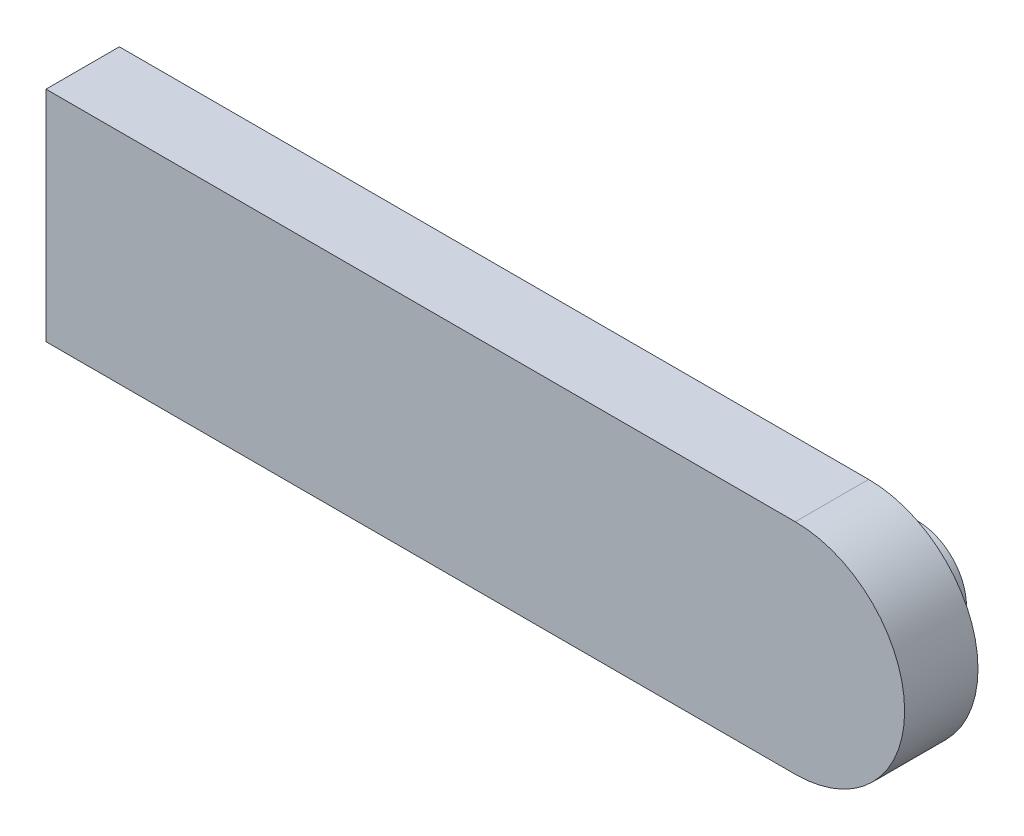
from build123d import *

# Parameters (mm, degrees)
SKETCH_1_W          = 300
SKETCH_1_H          = 44.73
EXTRUDE_1_DEPTH     = 15
CUT_EXTRUDE_4_REACH = 305.687
SKETCH_6_R          = 10
EXTRUDE_2_DEPTH     = 10
SKETCH_7_R          = 1
CUT_EXTRUDE_6_DEPTH = 5


with BuildPart() as part:
    # 草图1 → 凸台-拉伸1 (new body)
    with BuildSketch(Plane.XY):
        with Locations((150, 22.365)):
            Rectangle(SKETCH_1_W, SKETCH_1_H)
    extrude(amount=EXTRUDE_1_DEPTH)

    # 草图4 → 切除-拉伸4 (cut, up to next)
    with BuildSketch(Plane.XY.offset(15), mode=Mode.PRIVATE) as cut_extrude_4_sk1:
        with BuildLine():
            Line((300, 44.73), (153.211623388, 44.73))
            ThreePointArc((153.211623388, 44.73), (175.576623388, 22.365), (153.211623388, 0))
            Line((153.211623388, 0), (300, 0))
            Line((300, 0), (300, 44.73))
        make_face()
    cut_extrude_4_tool1 = extrude(cut_extrude_4_sk1.sketch, amount=-CUT_EXTRUDE_4_REACH, mode=Mode.PRIVATE) & part.part
    add(cut_extrude_4_tool1.solids().sort_by_distance((235.292113, 22.365, 15))[0], mode=Mode.SUBTRACT)

    # 草图6 → 凸台-拉伸2 (add)
    with BuildSketch(Plane(origin=(0, 0, 0), x_dir=(-1, 0, 0), z_dir=(0, 0, -1))):
        with Locations((-153.211623388, 22.365)):
            Circle(SKETCH_6_R)
    extrude(amount=EXTRUDE_2_DEPTH)

    # 草图7 → 切除-拉伸6 (cut)
    with BuildSketch(Plane(origin=(0, 0, -10), x_dir=(-1, 0, 0), z_dir=(0, 0, -1))):
        with Locations((-153.211623388, 29.365)):
            Circle(SKETCH_7_R)
        with Locations((-146.211623388, 22.365)):
            Circle(SKETCH_7_R)
        with Locations((-153.211623388, 15.365)):
            Circle(SKETCH_7_R)
        with Locations((-160.211623388, 22.365)):
            Circle(SKETCH_7_R)
    extrude(amount=-CUT_EXTRUDE_6_DEPTH, mode=Mode.SUBTRACT)


solid = part.part
